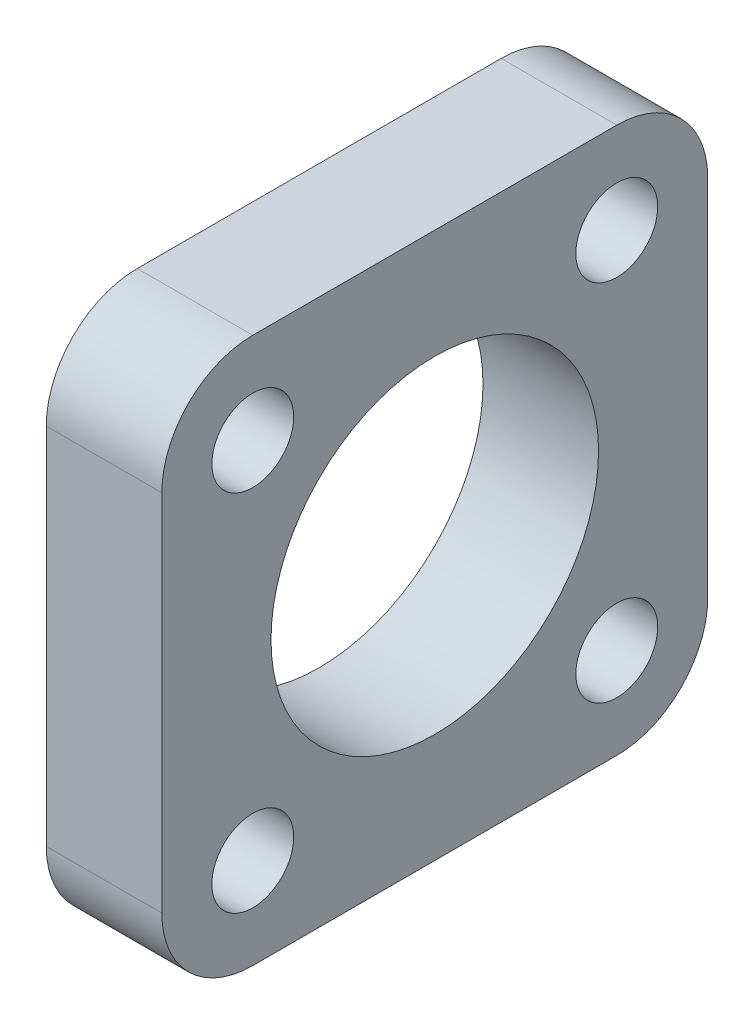
from build123d import *

# Parameters (mm, degrees)
CROQUIS1_W                   = 30
CROQUIS1_H                   = 30
CROQUIS1_R                   = 9
SALIENTE_EXTRUIR1_DEPTH      = 3.175
TALADRO_DE_MARGEN_PARA_M41_D = 4.5
REDONDEO1_R                  = 5


with BuildPart() as part:
    # Croquis1 → Saliente-Extruir1 (new, symmetric)
    with BuildSketch(Plane(origin=(0, 0, 0), x_dir=(0, 0, -1), z_dir=(1, 0, 0))):
        Rectangle(CROQUIS1_W, CROQUIS1_H)
        Circle(CROQUIS1_R, mode=Mode.SUBTRACT)
    extrude(amount=SALIENTE_EXTRUIR1_DEPTH, both=True)

    # Taladro de margen para M41 (through all)
    with Locations(Plane(origin=(3.175, 0, 0), x_dir=(0, 0, -1), z_dir=(1, 0, 0))):
        with Locations((-10, 10), (-10, -10), (10, -10), (10, 10)):
            Hole(TALADRO_DE_MARGEN_PARA_M41_D / 2)

    # Redondeo1
    redondeo1_edges = [part.edges().sort_by_distance(p)[0] for p in [
        (0, -15, -15),
        (0, -15, 15),
        (0, 15, 15),
        (0, 15, -15),
    ]]
    fillet(redondeo1_edges, radius=REDONDEO1_R)


solid = part.part
